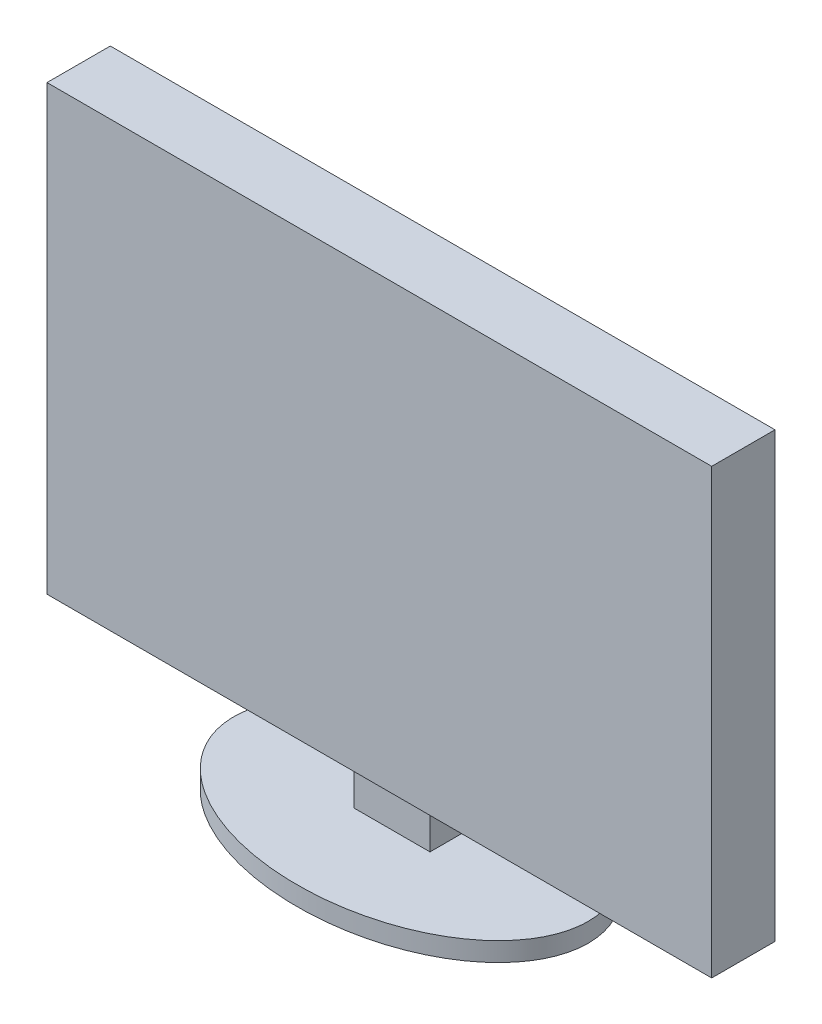
from build123d import *

# Parameters (mm, degrees)
SKETCH1_RX          = 140
SKETCH1_RY          = 90
BOSS_EXTRUDE1_DEPTH = 15
SKETCH2_W           = 60
SKETCH2_H           = 30
BOSS_EXTRUDE2_DEPTH = 35
SKETCH3_W           = 525
SKETCH3_H           = 50
BOSS_EXTRUDE3_DEPTH = 350


with BuildPart() as part:
    # Sketch1 → Boss-Extrude1 (new body)
    with BuildSketch(Plane(origin=(0, 0, 0), x_dir=(1, 0, 0), z_dir=(0, 1, 0))):
        with Locations((0, 0)):
            Ellipse(SKETCH1_RX, SKETCH1_RY)
    extrude(amount=BOSS_EXTRUDE1_DEPTH)

    # Sketch2 → Boss-Extrude2 (add)
    with BuildSketch(Plane(origin=(0, 15, 0), x_dir=(1, 0, 0), z_dir=(0, 1, 0))):
        Rectangle(SKETCH2_W, SKETCH2_H)
    extrude(amount=BOSS_EXTRUDE2_DEPTH)

    # Sketch3 → Boss-Extrude3 (add)
    with BuildSketch(Plane(origin=(0, 50, 0), x_dir=(1, 0, 0), z_dir=(0, 1, 0))):
        Rectangle(SKETCH3_W, SKETCH3_H)
    extrude(amount=BOSS_EXTRUDE3_DEPTH)


solid = part.part
